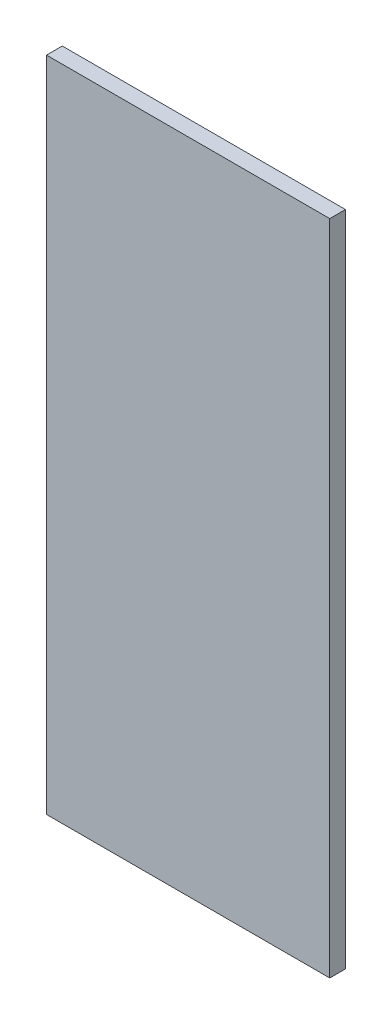
from build123d import *

# Parameters (mm, degrees)
SKETCH_1_W      = 900
SKETCH_1_H      = 2090
EXTRUDE_1_DEPTH = 50


with BuildPart() as part:
    # Эскиз1 → Бобышка-Вытянуть1 (new body)
    with BuildSketch(Plane.XY):
        with Locations((-450, 1045)):
            Rectangle(SKETCH_1_W, SKETCH_1_H)
    extrude(amount=EXTRUDE_1_DEPTH)


solid = part.part
